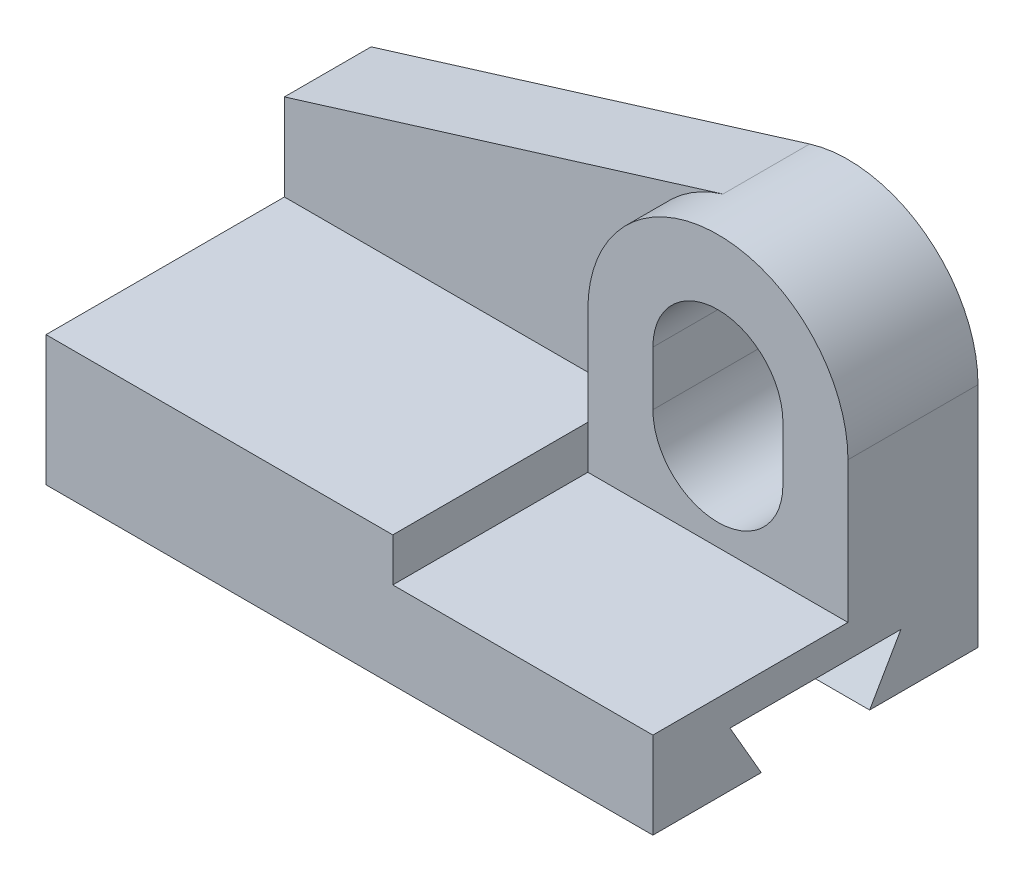
from build123d import *

# Parameters (mm, degrees)
EXTRUDE_1_DEPTH          = 8
EXTRUDE_START            = 4
EXTRUDE_2_DEPTH          = 4
EXTRUDE_3_DEPTH          = 22
CUT_EXTRUDE_1_DEPTH      = 65.412731661
CUT_EXTRUDE_1_DEPTH_BACK = 65.412731661


with BuildPart() as part:
    # 草图1 → 凸台-拉伸1 (new body)
    with BuildSketch(Plane.XY):
        with BuildLine():
            Line((-27.592823234, -10), (28.407176766, -10))
            Line((28.407176766, -10), (28.407176766, 11))
            ThreePointArc((28.407176766, 11), (23.534575752, 20.654024223), (12.873812817, 22.468013743))
            Line((12.873812817, 22.468013743), (-27.592823234, 10))
            Line((-27.592823234, 10), (-27.592823234, -10))
        make_face()
        with BuildLine():
            ThreePointArc((22.407176766, 6), (16.407176766, 0), (10.407176766, 6))
            Line((10.407176766, 6), (10.407176766, 11))
            ThreePointArc((10.407176766, 11), (16.407176766, 17), (22.407176766, 11))
            Line((22.407176766, 11), (22.407176766, 6))
        make_face(mode=Mode.SUBTRACT)
    extrude(amount=-EXTRUDE_1_DEPTH)

    # 草图1<3> → 凸台-拉伸2 (add)
    with BuildSketch(Plane.XY.offset(EXTRUDE_START)):
        with BuildLine():
            Line((4.407176766, -2), (28.407176766, -2))
            Line((28.407176766, -2), (28.407176766, 11))
            ThreePointArc((28.407176766, 11), (23.534575752, 20.654024223), (12.873812817, 22.468013743))
            ThreePointArc((12.873812817, 22.468013743), (6.753152543, 18.127398986), (4.407176766, 11))
            Line((4.407176766, 11), (4.407176766, 2))
            Line((4.407176766, 2), (4.407176766, -2))
        make_face()
        with BuildLine():
            ThreePointArc((10.407176766, 11), (16.407176766, 17), (22.407176766, 11))
            Line((22.407176766, 11), (22.407176766, 6))
            ThreePointArc((22.407176766, 6), (16.407176766, 0), (10.407176766, 6))
            Line((10.407176766, 6), (10.407176766, 11))
        make_face(mode=Mode.SUBTRACT)
    extrude(amount=-EXTRUDE_2_DEPTH)

    # 草图1<4> → 凸台-拉伸3 (add)
    with BuildSketch(Plane.XY):
        Polygon((-27.592823234, -10), (28.407176766, -10), (28.407176766, -2), (4.407176766, -2), (4.407176766, 2), (-27.592823234, 2), align=None)
    extrude(amount=EXTRUDE_3_DEPTH)

    # 草图3 → 切除-拉伸1 (cut, two sides: drawn at the far end of the back side and taken through both)
    with BuildSketch(Plane.ZY.offset(27.592823234).offset(-CUT_EXTRUDE_1_DEPTH_BACK)):
        Polygon((2, -10), (-0.886751346, -5), (14.886751346, -5), (12, -10), align=None)
    extrude(amount=CUT_EXTRUDE_1_DEPTH + CUT_EXTRUDE_1_DEPTH_BACK, mode=Mode.SUBTRACT)


solid = part.part
